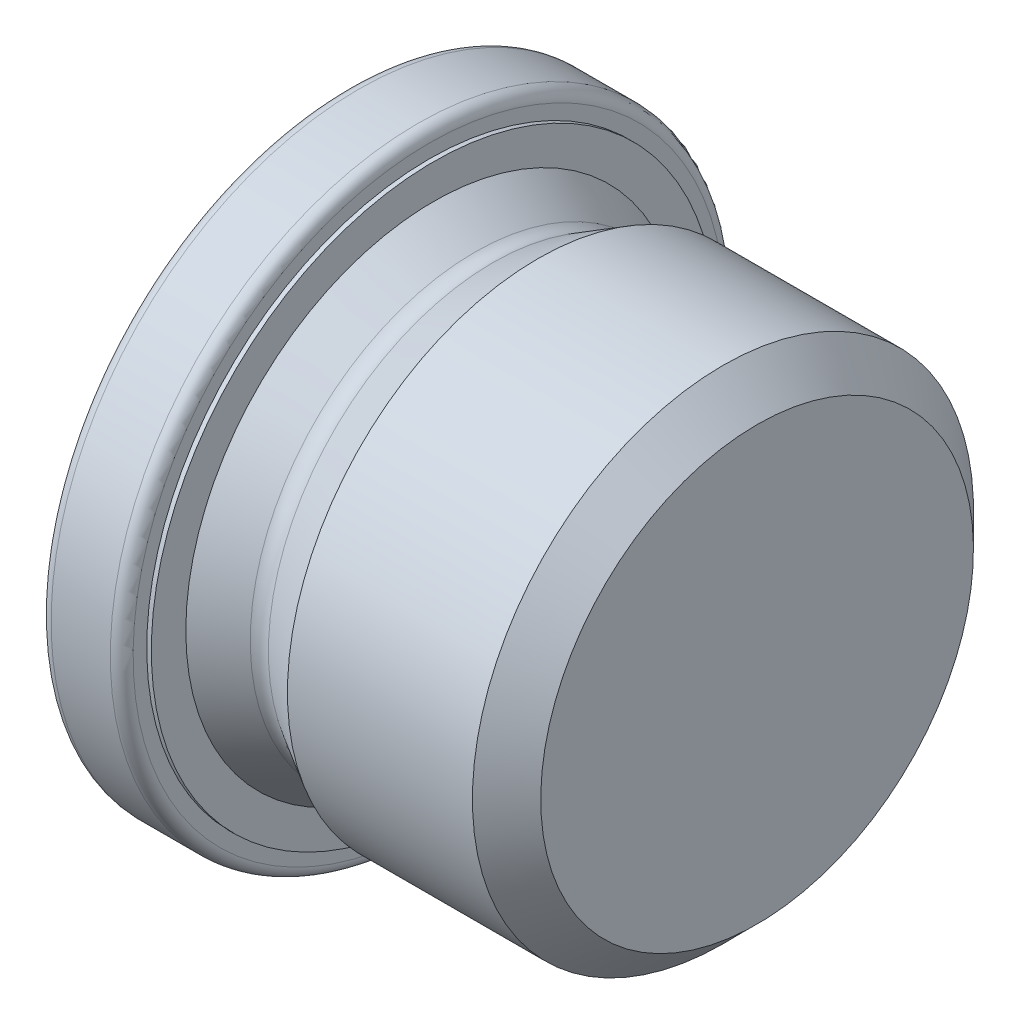
from build123d import *

# Parameters (mm, degrees)
SKETCH2_W          = 9.6
SKETCH2_H          = 9.6
CUT_EXTRUDE1_DEPTH = 10
FILLET1_R          = 0.5
SKETCH3_W          = 1.5
SKETCH3_H          = 2


with BuildPart() as part:
    # Sketch1 → Revolve1 (revolve)
    with BuildSketch(Plane.XY):
        with BuildLine():
            Line((0, 0), (0, 9.5))
            Line((0, 9.5), (-1.5, 11))
            Line((-1.5, 11), (-9.622450166, 11))
            Line((-9.622450166, 11), (-11.60187303, 9.857179677))
            ThreePointArc((-11.60187303, 9.857179677), (-12.000249041, 9.750001648), (-12.399056907, 9.855561401))
            Line((-12.399056907, 9.855561401), (-14.4, 11))
            Line((-14.4, 11), (-14.4, 13.5))
            Line((-14.4, 13.5), (-18, 13.5))
            Line((-18, 13.5), (-18, 0))
            Line((-18, 0), (0, 0))
        make_face()
    revolve(axis=Axis((0, 0, 0), (-1, 0, 0)))

    # Sketch2 → Cut-Extrude1 (cut)
    with BuildSketch(Plane.ZY.offset(18)):
        Rectangle(SKETCH2_W, SKETCH2_H)
    extrude(amount=-CUT_EXTRUDE1_DEPTH, mode=Mode.SUBTRACT)

    # Fillet1
    fillet1_edges = [part.edges().sort_by_distance(p)[0] for p in [
        (-14.4, -13.5, 0),
        (-18, -13.5, 0),
    ]]
    fillet(fillet1_edges, radius=FILLET1_R)

    # Sketch3 → Revolve2 (revolve)
    with BuildSketch(Plane.XY, mode=Mode.PRIVATE) as revolve2_sk:
        with Locations((-14.95, 11.4)):
            Rectangle(SKETCH3_W, SKETCH3_H)
    revolve(revolve2_sk.sketch.rotate(Axis((0, 0, 0), (-1, 0, 0)), 90), axis=Axis((0, 0, 0), (-1, 0, 0)))


solid = part.part
